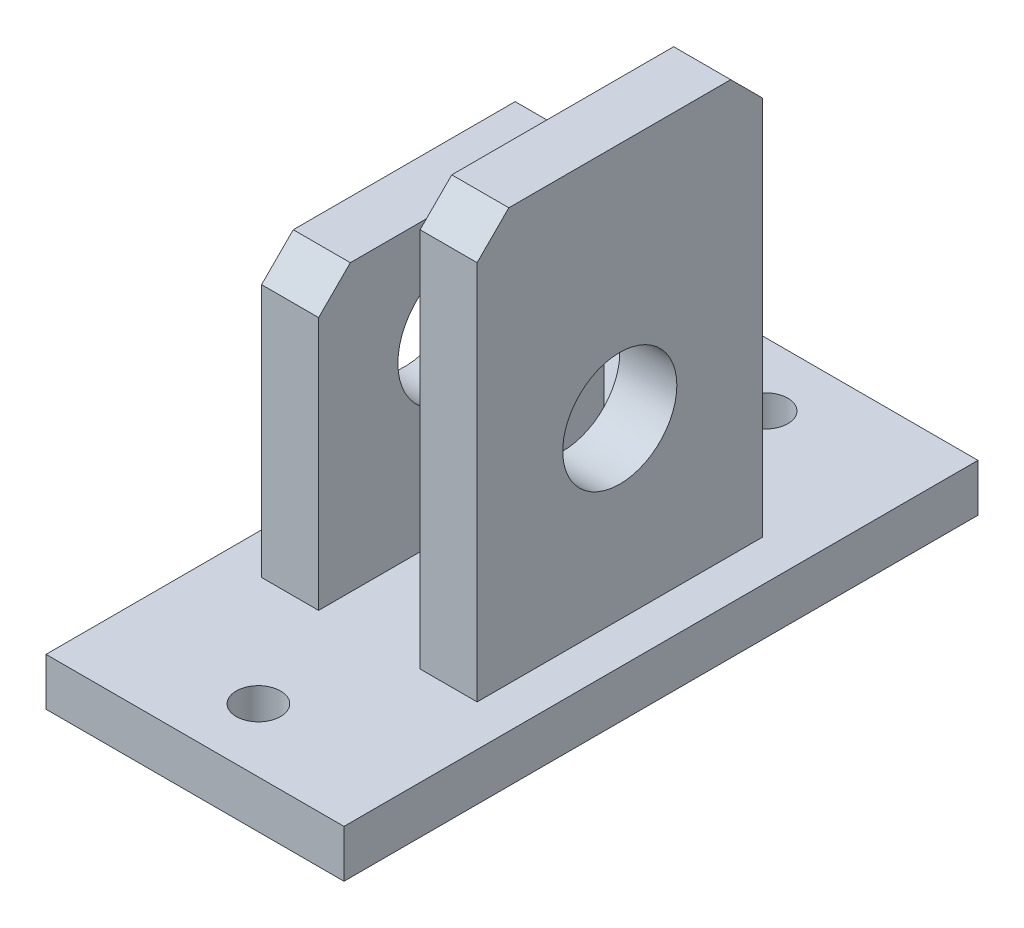
from build123d import *

# Parameters (mm, degrees)
SCHIZZO1_W        = 94
SCHIZZO1_H        = 200
ESTRUSIONE1_DEPTH = 15
SCHIZZO2_W        = 18
SCHIZZO2_H        = 90
ESTRUSIONE2_DEPTH = 90
SCHIZZO3_R        = 7
ESTRUSIONE3_DEPTH = 90
SCHIZZO4_R        = 18
ESTRUSIONE4_DEPTH = 240.970831561
SCHIZZO5_R        = 20
ESTRUSIONE5_DEPTH = 20
SCHIZZO7_W        = 18
SCHIZZO7_H        = 90
ESTRUSIONE6_DEPTH = 40
SMUSSO1_SIZE      = 10


with BuildPart() as part:
    # Schizzo1 → Estrusione1 (new body)
    with BuildSketch(Plane(origin=(0, 0, 0), x_dir=(1, 0, 0), z_dir=(0, 1, 0))):
        with Locations((47, 100)):
            Rectangle(SCHIZZO1_W, SCHIZZO1_H)
    extrude(amount=ESTRUSIONE1_DEPTH)

    # Schizzo2 → Estrusione2 (add)
    with BuildSketch(Plane(origin=(0, 15, 0), x_dir=(1, 0, 0), z_dir=(0, 1, 0))):
        with Locations((72, 100)):
            Rectangle(SCHIZZO2_W, SCHIZZO2_H)
        with Locations((22, 100)):
            Rectangle(SCHIZZO2_W, SCHIZZO2_H)
    extrude(amount=ESTRUSIONE2_DEPTH)

    # Schizzo3 → Estrusione3 (cut)
    with BuildSketch(Plane(origin=(0, 15, 0), x_dir=(1, 0, 0), z_dir=(0, 1, 0))):
        with Locations(Location((47, 180, 0), (0, 0, 270))):
            Circle(SCHIZZO3_R)
        with Locations(Location((47, 20, 0), (0, 0, 270))):
            Circle(SCHIZZO3_R)
    extrude(amount=-ESTRUSIONE3_DEPTH, mode=Mode.SUBTRACT)

    # Schizzo4 → Estrusione4 (cut, through all)
    with BuildSketch(Plane(origin=(81, 0, 0), x_dir=(0, 0, -1), z_dir=(1, 0, 0))):
        with Locations((100, 70)):
            Circle(SCHIZZO4_R)
    extrude(amount=-ESTRUSIONE4_DEPTH, mode=Mode.SUBTRACT)

    # Schizzo5 → Estrusione5 (cut)
    with BuildSketch(Plane.ZY.offset(-13)):
        with Locations((-100, 70)):
            Circle(SCHIZZO5_R)
    extrude(amount=-ESTRUSIONE5_DEPTH, mode=Mode.SUBTRACT)

    # Schizzo7 → Estrusione6 (add)
    with BuildSketch(Plane(origin=(0, 105, 0), x_dir=(1, 0, 0), z_dir=(0, 1, 0))):
        with Locations((72, 100)):
            Rectangle(SCHIZZO7_W, SCHIZZO7_H)
    extrude(amount=ESTRUSIONE6_DEPTH)

    # Smusso1
    smusso1_edges = [part.edges().sort_by_distance(p)[0] for p in [
        (22, 105, -55),
        (22, 105, -145),
        (72, 145, -55),
        (72, 145, -145),
    ]]
    chamfer(smusso1_edges, length=SMUSSO1_SIZE)


solid = part.part
